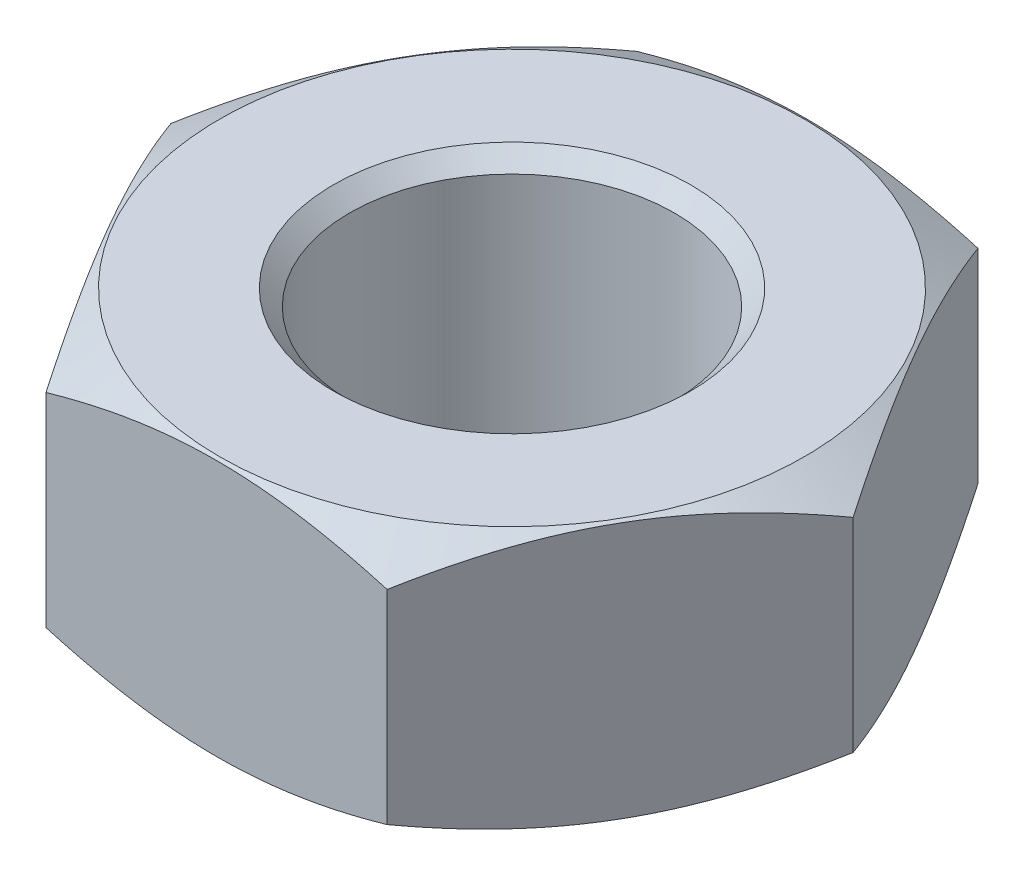
from build123d import *

# Parameters (mm, degrees)
EXTRUDE_1_DEPTH     = 1.6
SKETCH_2_R          = 1
CUT_EXTRUDE_1_DEPTH = 1.6
CHAMFER_1_SIZE      = 0.1


with BuildPart() as part:
    # Эскиз1 → Вытянуть1 (new body)
    with BuildSketch(Plane(origin=(0, 0, 0), x_dir=(1, 0, 0), z_dir=(0, 1, 0))):
        Polygon((-1.050000001, 1.81865335), (1.050000001, 1.81865335), (2.1, 4e-09), (1.049999996, -1.81865335), (-1.050000001, -1.81865335), (-2.100000002, 0), align=None)
    extrude(amount=-EXTRUDE_1_DEPTH)

    # Эскиз2 → Вырез-Вытянуть1 (cut)
    with BuildSketch(Plane(origin=(0, 0, 0), x_dir=(-1, 0, 0), z_dir=(0, 1, 0))):
        with Locations(Location((0, 0, 0), (0, 0, 90))):
            Circle(SKETCH_2_R)
    extrude(amount=-CUT_EXTRUDE_1_DEPTH, mode=Mode.SUBTRACT)

    # Фаска1
    chamfer_1_edges = [part.edges().sort_by_distance(p)[0] for p in [
        (0, -1.6, -1),
        (0, 0, -1),
    ]]
    chamfer(chamfer_1_edges, length=CHAMFER_1_SIZE)

    # Эскиз3 → Вырез-Повернуть1 (revolve, cut)
    with BuildSketch(Plane.XY, mode=Mode.PRIVATE) as cut_revolve_1_sk:
        Polygon((-1.8, 0), (-2.100000002, -0.173205082), (-2.100000002, 0), align=None)
        Polygon((-2.100000002, -1.6), (-2.100000002, -1.426794918), (-1.8, -1.6), align=None)
    revolve(cut_revolve_1_sk.sketch.rotate(Axis((0, 0, 0), (0, -1, 0)), 90), axis=Axis((0, 0, 0), (0, -1, 0)), mode=Mode.SUBTRACT)


solid = part.part
